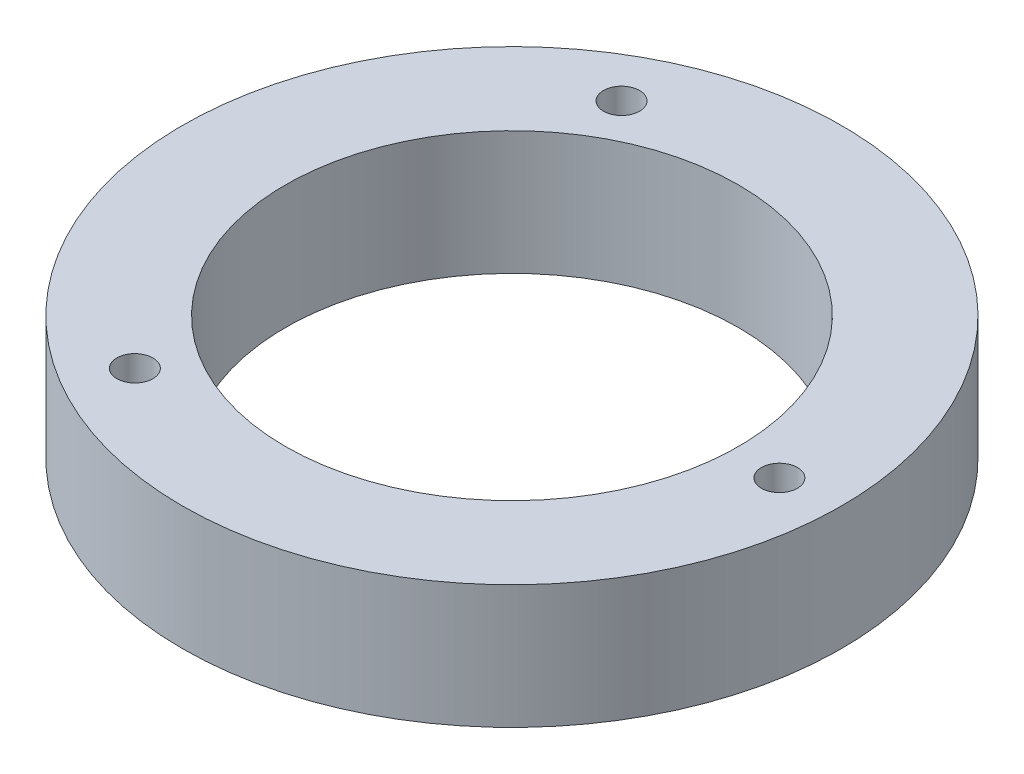
from build123d import *

# Parameters (mm, degrees)
SKETCH1_R           = 32
SKETCH1_R_2         = 22
SKETCH1_R_3         = 1.75
BOSS_EXTRUDE1_DEPTH = 12


with BuildPart() as part:
    # Sketch1 → Boss-Extrude1 (new body)
    with BuildSketch(Plane(origin=(0, 0, 0), x_dir=(1, 0, 0), z_dir=(0, 1, 0))):
        with Locations(Location((0, 0, 0), (0, 0, 270))):
            Circle(SKETCH1_R)
        with Locations(Location((0, 0, 0), (0, 0, 270))):
            Circle(SKETCH1_R_2, mode=Mode.SUBTRACT)
        with Locations(Location((26.625678067, -0.655369856, 0), (0, 0, 270))):
            Circle(SKETCH1_R_3, mode=Mode.SUBTRACT)
        with Locations(Location((-13.880405978, -22.730828671, 0), (0, 0, 270))):
            Circle(SKETCH1_R_3, mode=Mode.SUBTRACT)
        with Locations(Location((-12.745272089, 23.386198527, 0), (0, 0, 270))):
            Circle(SKETCH1_R_3, mode=Mode.SUBTRACT)
    extrude(amount=BOSS_EXTRUDE1_DEPTH)


solid = part.part
